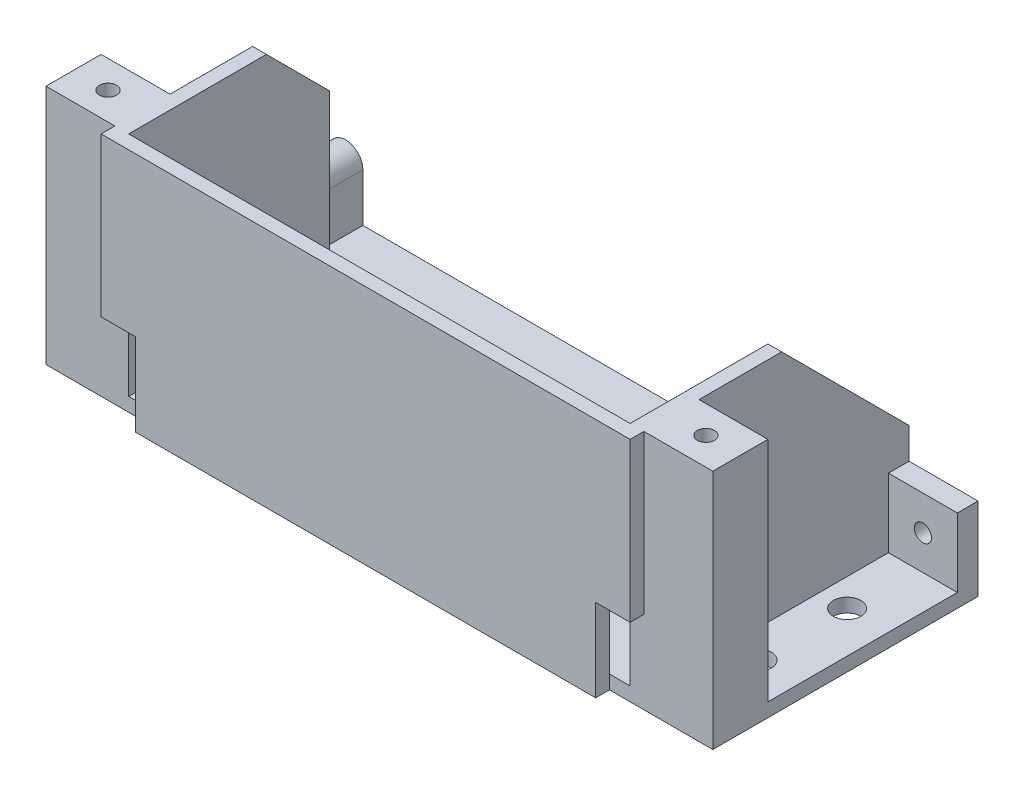
from build123d import *

# Parameters (mm, degrees)
CROQUIS1_W              = 96.8
CROQUIS1_H              = 40.5
SALIENTE_EXTRUIR1_DEPTH = 2
CROQUIS4_W              = 76.8
CROQUIS4_H              = 40.5
CROQUIS4_W_2            = 72.8
CROQUIS4_H_2            = 36.5
SALIENTE_EXTRUIR6_DEPTH = 33
CORTAR_EXTRUIR2_START   = 10
CROQUIS2_W              = 15
CROQUIS2_H              = 2
CORTAR_EXTRUIR2_DEPTH   = 12
CORTAR_EXTRUIR4_DEPTH   = 33
CORTAR_EXTRUIR5_DEPTH   = 96.756474977
CROQUIS7_R              = 2
CORTAR_EXTRUIR6_DEPTH   = 12
CROQUIS8_W              = 10
CROQUIS8_H              = 3
SALIENTE_EXTRUIR7_DEPTH = 10
SALIENTE_EXTRUIR9_DEPTH = 9.340280327
CROQUIS9_W              = 10
CROQUIS9_H              = 8
SALIENTE_EXTRUIR8_DEPTH = 33
CROQUIS10_R             = 1.25
CORTAR_EXTRUIR7_DEPTH   = 10
CORTAR_EXTRUIR8_REACH   = 74.165
CROQUIS11_R             = 1.25


with BuildPart() as part:
    # Croquis1 → Saliente-Extruir1 (new body)
    with BuildSketch(Plane(origin=(0, 0, 0), x_dir=(1, 0, 0), z_dir=(0, 1, 0))):
        Rectangle(CROQUIS1_W, CROQUIS1_H)
    extrude(amount=SALIENTE_EXTRUIR1_DEPTH)

    # Croquis4 → Saliente-Extruir6 (add)
    with BuildSketch(Plane(origin=(0, 2, 0), x_dir=(1, 0, 0), z_dir=(0, 1, 0))):
        Rectangle(CROQUIS4_W, CROQUIS4_H)
        Rectangle(CROQUIS4_W_2, CROQUIS4_H_2, mode=Mode.SUBTRACT)
    extrude(amount=SALIENTE_EXTRUIR6_DEPTH)

    # Croquis2 → Cortar-Extruir2 (cut)
    with BuildSketch(Plane(origin=(0, 2, 0), x_dir=(1, 0, 0), z_dir=(0, 1, 0)).offset(CORTAR_EXTRUIR2_START)):
        with Locations((-40.9, -19.25)):
            Rectangle(CROQUIS2_W, CROQUIS2_H)
        with Locations((40.9, -19.25)):
            Rectangle(CROQUIS2_W, CROQUIS2_H)
    extrude(amount=-CORTAR_EXTRUIR2_DEPTH, mode=Mode.SUBTRACT)

    # Croquis6 → Cortar-Extruir4 (cut)
    with BuildSketch(Plane(origin=(0, 35, 0), x_dir=(1, 0, 0), z_dir=(0, 1, 0))):
        Polygon((36.4, 18.25), (-36.4, 18.25), (-36.4, 10.909719673), (-38.4, 10.909719673), (-38.4, 20.25), (36.4, 20.25), align=None)
    extrude(amount=-CORTAR_EXTRUIR4_DEPTH, mode=Mode.SUBTRACT)

    # Croquis5 → Cortar-Extruir5 (cut, through all)
    with BuildSketch(Plane(origin=(38.4, 0, 0), x_dir=(0, 0, -1), z_dir=(1, 0, 0))):
        Polygon((1.75, 35), (20.25, 16.5), (20.25, 35), align=None)
    extrude(amount=-CORTAR_EXTRUIR5_DEPTH, mode=Mode.SUBTRACT)

    # Croquis7 → Cortar-Extruir6 (cut)
    with BuildSketch(Plane(origin=(0, 2, 0), x_dir=(1, 0, 0), z_dir=(0, 1, 0))):
        with Locations(Location((42.4, 7.25, 0), (0, 0, 270))):
            Circle(CROQUIS7_R)
        with Locations(Location((42.4, -5.75, 0), (0, 0, 270))):
            Circle(CROQUIS7_R)
        with Locations(Location((-42.9, 5.25, 0), (0, 0, 270))):
            Circle(CROQUIS7_R)
        with Locations(Location((-42.9, -7.75, 0), (0, 0, 270))):
            Circle(CROQUIS7_R)
    extrude(amount=-CORTAR_EXTRUIR6_DEPTH, mode=Mode.SUBTRACT)

    # Croquis8 → Saliente-Extruir7 (add)
    with BuildSketch(Plane(origin=(0, 2, 0), x_dir=(1, 0, 0), z_dir=(0, 1, 0))):
        with Locations((43.4, 18.75)):
            Rectangle(CROQUIS8_W, CROQUIS8_H)
        with Locations((-43.4, 9.409719673)):
            Rectangle(CROQUIS8_W, CROQUIS8_H)
    extrude(amount=SALIENTE_EXTRUIR7_DEPTH)

    # Croquis13 → Saliente-Extruir9 (add)
    with BuildSketch(Plane(origin=(0, 0, -10.909719673), x_dir=(-1, 0, 0), z_dir=(0, 0, -1))):
        with BuildLine():
            Line((45.9, 2), (40.9, 2))
            Line((40.9, 2), (40.9, 9))
            ThreePointArc((40.9, 9), (43.4, 11.5), (45.9, 9))
            Line((45.9, 9), (45.9, 2))
        make_face()
    extrude(amount=SALIENTE_EXTRUIR9_DEPTH)

    # Croquis9 → Saliente-Extruir8 (add)
    with BuildSketch(Plane(origin=(0, 2, 0), x_dir=(1, 0, 0), z_dir=(0, 1, 0))):
        with Locations((-43.4, -14.25)):
            Rectangle(CROQUIS9_W, CROQUIS9_H)
        with Locations((43.4, -14.25)):
            Rectangle(CROQUIS9_W, CROQUIS9_H)
    extrude(amount=SALIENTE_EXTRUIR8_DEPTH)

    # Croquis10 → Cortar-Extruir7 (cut)
    with BuildSketch(Plane(origin=(0, 35, 0), x_dir=(1, 0, 0), z_dir=(0, 1, 0))):
        with Locations(Location((-43.4, -14.25, 0), (0, 0, 270))):
            Circle(CROQUIS10_R)
        with Locations(Location((43.4, -14.25, 0), (0, 0, 270))):
            Circle(CROQUIS10_R)
    extrude(amount=-CORTAR_EXTRUIR7_DEPTH, mode=Mode.SUBTRACT)

    # Cortar-Extruir8: up to this face of the body (flat: up to its plane)
    cortar_extruir8_end = Plane(part.part.faces().sort_by_distance((-43.4, 7, -7.909719673))[0])
    # Croquis11 → Cortar-Extruir8 (cut, up to the picked face)
    with BuildSketch(Plane(origin=(0, 0, -20.25), x_dir=(-1, 0, 0), z_dir=(0, 0, -1)), mode=Mode.PRIVATE) as cortar_extruir8_sk1:
        with Locations((-43.4, 7)):
            Circle(CROQUIS11_R)
    cortar_extruir8_tool1 = split(extrude(cortar_extruir8_sk1.sketch, amount=-CORTAR_EXTRUIR8_REACH, mode=Mode.PRIVATE), bisect_by=cortar_extruir8_end, keep=Keep.BOTH, mode=Mode.PRIVATE)
    # Croquis11 → Cortar-Extruir8 (cut, up to the picked face)
    with BuildSketch(Plane(origin=(0, 0, -20.25), x_dir=(-1, 0, 0), z_dir=(0, 0, -1)), mode=Mode.PRIVATE) as cortar_extruir8_sk2:
        with Locations((43.4, 7)):
            Circle(CROQUIS11_R)
    cortar_extruir8_tool2 = split(extrude(cortar_extruir8_sk2.sketch, amount=-CORTAR_EXTRUIR8_REACH, mode=Mode.PRIVATE), bisect_by=cortar_extruir8_end, keep=Keep.BOTH, mode=Mode.PRIVATE)
    add(cortar_extruir8_tool1.solids().sort_by(Axis((43.4, 7, -20.25), (0, 0, 1)))[0], mode=Mode.SUBTRACT)
    add(cortar_extruir8_tool2.solids().sort_by(Axis((-43.4, 7, -20.25), (0, 0, 1)))[0], mode=Mode.SUBTRACT)


solid = part.part
